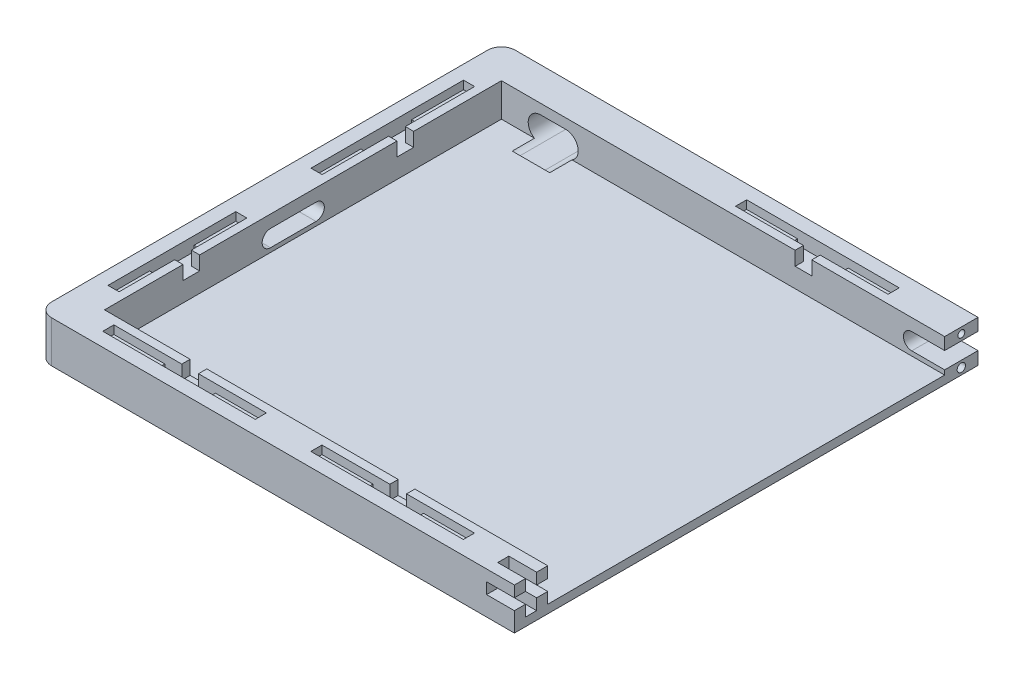
from build123d import *

# Parameters (mm, degrees)
SKETCH1_W           = 159.54
SKETCH1_H           = 142.875
BOSS_EXTRUDE1_DEPTH = 3
BOSS_EXTRUDE2_DEPTH = 15
CUT_EXTRUDE1_DEPTH  = 3
CUT_EXTRUDE2_DEPTH  = 2
CUT_EXTRUDE3_DEPTH  = 12
CUT_EXTRUDE5_DEPTH  = 12
CUT_EXTRUDE6_DEPTH  = 20
CUT_EXTRUDE8_DEPTH  = 10
FILLET2_R           = 5
FILLET3_R           = 5
SKETCH11_R          = 1.5
SKETCH11_R_2        = 1.25
CUT_EXTRUDE9_DEPTH  = 10


with BuildPart() as part:
    # Sketch1 → Boss-Extrude1 (new body)
    with BuildSketch(Plane(origin=(0, 0, 0), x_dir=(1, 0, 0), z_dir=(0, 1, 0))):
        with Locations((-79.77, 0)):
            Rectangle(SKETCH1_W, SKETCH1_H)
    extrude(amount=BOSS_EXTRUDE1_DEPTH)

    # Sketch2 → Boss-Extrude2 (add)
    with BuildSketch(Plane(origin=(0, 0, 0), x_dir=(1, 0, 0), z_dir=(0, 1, 0))):
        Polygon((0, 71.4375), (0, 83.4375), (-171.54, 83.4375), (-171.54, -83.4375), (0, -83.4375), (0, -71.4375), (-159.54, -71.4375), (-159.54, 71.4375), align=None)
    extrude(amount=BOSS_EXTRUDE2_DEPTH)

    # Sketch3 → Cut-Extrude1 (cut)
    with BuildSketch(Plane(origin=(0, 15, 0), x_dir=(1, 0, 0), z_dir=(0, 1, 0))):
        Polygon((-159.54, 39.8375), (-159.54, 33.8375), (-162.54, 33.8375), (-162.54, 9.888405135), (-166.54, 9.888405135), (-166.54, 64.788405135), (-162.54, 64.788405135), (-162.54, 39.8375), align=None)
        Polygon((-23.37, -74.4375), (-47.82, -74.4375), (-47.82, -71.4375), (-53.82, -71.4375), (-53.82, -74.4375), (-78.27, -74.4375), (-78.27, -78.4375), (-23.37, -78.4375), align=None)
        Polygon((-159.54, -37.1875), (-159.54, -43.1875), (-162.54, -43.1875), (-162.54, -63.1875), (-166.54, -63.1875), (-166.54, -17.1875), (-162.54, -17.1875), (-162.54, -37.1875), align=None)
        Polygon((-98.27, -78.4375), (-98.27, -74.4375), (-122.72, -74.4375), (-122.72, -71.4375), (-128.72, -71.4375), (-128.72, -74.4375), (-153.17, -74.4375), (-153.17, -78.4375), align=None)
        Polygon((-47.82, 74.4375), (-47.82, 71.4375), (-53.82, 71.4375), (-53.82, 74.4375), (-78.27, 74.4375), (-78.27, 78.4375), (-23.37, 78.4375), (-23.37, 74.4375), align=None)
    extrude(amount=-CUT_EXTRUDE1_DEPTH, mode=Mode.SUBTRACT)

    # Sketch4 → Cut-Extrude2 (cut)
    with BuildSketch(Plane(origin=(0, 12, 0), x_dir=(1, 0, 0), z_dir=(0, 1, 0))):
        Polygon((-53.82, 74.4375), (-53.82, 71.4375), (-47.82, 71.4375), (-47.82, 74.4375), (-41.7075, 74.4375), (-41.7075, 78.4375), (-50.82, 78.4375), (-59.9325, 78.4375), (-59.9325, 74.4375), align=None)
        Polygon((-159.54, 39.8375), (-159.54, 33.8375), (-162.54, 33.8375), (-162.54, 27.850226284), (-166.54, 27.850226284), (-166.54, 46.075226284), (-162.54, 46.075226284), (-162.54, 39.8375), align=None)
        Polygon((-166.54, -32.1875), (-166.54, -48.1875), (-162.54, -48.1875), (-162.54, -43.1875), (-159.54, -43.1875), (-159.54, -37.1875), (-162.54, -37.1875), (-162.54, -32.1875), align=None)
        Polygon((-128.72, -71.4375), (-128.72, -74.4375), (-134.8325, -74.4375), (-134.8325, -78.4375), (-116.6075, -78.4375), (-116.6075, -74.4375), (-122.72, -74.4375), (-122.72, -71.4375), align=None)
        Polygon((-53.82, -74.4375), (-59.9325, -74.4375), (-59.9325, -78.4375), (-41.7075, -78.4375), (-41.7075, -74.4375), (-47.82, -74.4375), (-47.82, -71.4375), (-53.82, -71.4375), align=None)
    extrude(amount=-CUT_EXTRUDE2_DEPTH, mode=Mode.SUBTRACT)

    # Sketch5 → Cut-Extrude3 (cut)
    with BuildSketch(Plane.ZY.offset(171.54)):
        with BuildLine():
            Line((-4.6875, 10.5), (11.6925, 10.5))
            ThreePointArc((11.6925, 10.5), (14.6925, 7.5), (11.6925, 4.5))
            Line((11.6925, 4.5), (-4.6875, 4.5))
            ThreePointArc((-4.6875, 4.5), (-7.6875, 7.5), (-4.6875, 10.5))
        make_face()
    extrude(amount=-CUT_EXTRUDE3_DEPTH, mode=Mode.SUBTRACT)

    # Sketch7 → Cut-Extrude5 (cut)
    with BuildSketch(Plane(origin=(0, 0, -83.4375), x_dir=(-1, 0, 0), z_dir=(0, 0, -1))):
        with BuildLine():
            Line((-4.5375, 10.634328206), (11.8425, 10.634328206))
            ThreePointArc((11.8425, 10.634328206), (14.8425, 7.634328206), (11.8425, 4.634328206))
            Line((11.8425, 4.634328206), (-4.5375, 4.634328206))
            ThreePointArc((-4.5375, 4.634328206), (-7.5375, 7.634328206), (-4.5375, 10.634328206))
        make_face()
    extrude(amount=-CUT_EXTRUDE5_DEPTH, mode=Mode.SUBTRACT)

    # Sketch8 → Cut-Extrude6 (cut)
    with BuildSketch(Plane(origin=(0, 0, -83.4375), x_dir=(-1, 0, 0), z_dir=(0, 0, -1))):
        with BuildLine():
            Line((136.4, 11.4), (145.4, 11.4))
            ThreePointArc((145.4, 11.4), (149.9, 6.9), (145.4, 2.4))
            Line((145.4, 2.4), (136.4, 2.4))
            ThreePointArc((136.4, 2.4), (131.9, 6.9), (136.4, 11.4))
        make_face()
    extrude(amount=-CUT_EXTRUDE6_DEPTH, mode=Mode.SUBTRACT)

    # Sketch10 → Cut-Extrude8 (cut)
    with BuildSketch(Plane(origin=(0, 0, 0), x_dir=(0, 0, -1), z_dir=(1, 0, 0))):
        Polygon((-79.4375, 15), (-75.4375, 15), (-75.4375, 11), (-71.4375, 11), (-71.4375, 7), (-75.4375, 7), (-75.4375, 3), (-79.4375, 3), (-79.4375, 7), (-83.4375, 7), (-83.4375, 11), (-79.4375, 11), align=None)
    extrude(amount=-CUT_EXTRUDE8_DEPTH, mode=Mode.SUBTRACT)

    # Fillet2
    fillet2_edges = [part.edges().sort_by_distance(p)[0] for p in [
        (-171.54, 7.5, 83.4375),
    ]]
    fillet(fillet2_edges, radius=FILLET2_R)

    # Fillet3
    fillet3_edges = [part.edges().sort_by_distance(p)[0] for p in [
        (-171.54, 7.5, -83.4375),
    ]]
    fillet(fillet3_edges, radius=FILLET3_R)

    # Sketch11 → Cut-Extrude9 (cut)
    with BuildSketch(Plane(origin=(0, 0, 0), x_dir=(0, 0, -1), z_dir=(1, 0, 0))):
        with Locations((77.4375, 2.317164103)):
            Circle(SKETCH11_R)
        with Locations((77.4375, 12.817164103)):
            Circle(SKETCH11_R_2)
    extrude(amount=-CUT_EXTRUDE9_DEPTH, mode=Mode.SUBTRACT)


solid = part.part
